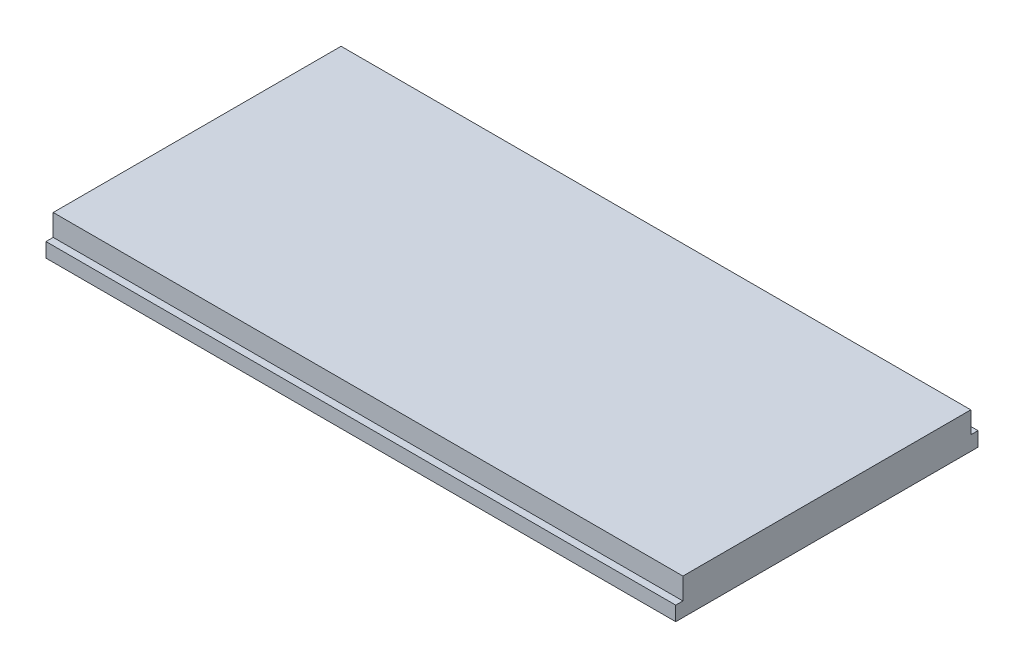
from build123d import *

# Parameters (mm, degrees)
SKETCH1_W           = 87.5
SKETCH1_H           = 42
BOSS_EXTRUDE1_DEPTH = 5
SKETCH2_W           = 87.5
SKETCH2_H           = 1
CUT_EXTRUDE1_DEPTH  = 3
SKETCH3_W           = 87.5
SKETCH3_H           = 1
CUT_EXTRUDE2_DEPTH  = 3


with BuildPart() as part:
    # Sketch1 → Boss-Extrude1 (new body)
    with BuildSketch(Plane(origin=(0, 0, 0), x_dir=(1, 0, 0), z_dir=(0, 1, 0))):
        Rectangle(SKETCH1_W, SKETCH1_H)
    extrude(amount=BOSS_EXTRUDE1_DEPTH)

    # Sketch2 → Cut-Extrude1 (cut)
    with BuildSketch(Plane(origin=(0, 5, 0), x_dir=(1, 0, 0), z_dir=(0, 1, 0))):
        with Locations((0, 20.5)):
            Rectangle(SKETCH2_W, SKETCH2_H)
    extrude(amount=-CUT_EXTRUDE1_DEPTH, mode=Mode.SUBTRACT)

    # Sketch3 → Cut-Extrude2 (cut)
    with BuildSketch(Plane(origin=(0, 5, 0), x_dir=(1, 0, 0), z_dir=(0, 1, 0))):
        with Locations((0, -20.5)):
            Rectangle(SKETCH3_W, SKETCH3_H)
    extrude(amount=-CUT_EXTRUDE2_DEPTH, mode=Mode.SUBTRACT)


solid = part.part
